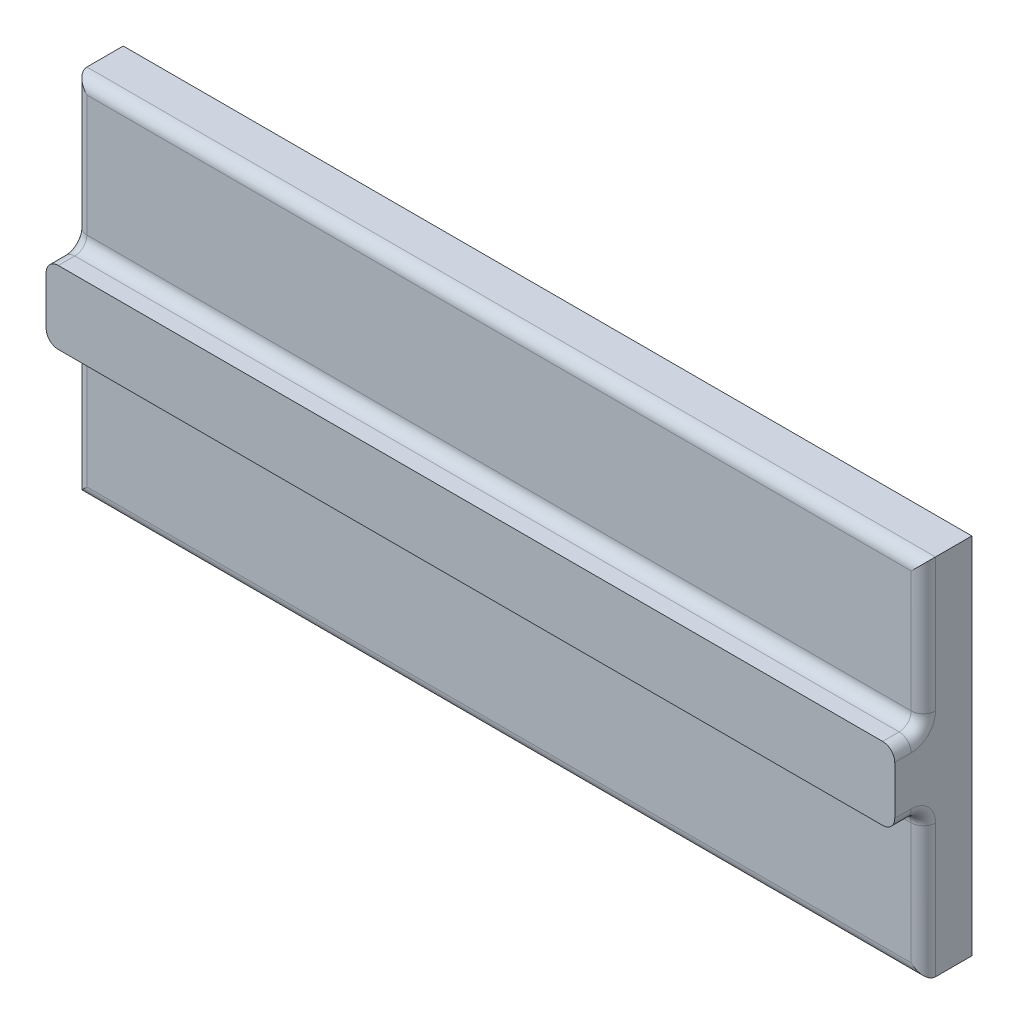
from build123d import *

# Parameters (mm, degrees)
SALIENTE_EXTRUIR1_DEPTH = 175
REDONDEO1_R             = 5


with BuildPart() as part:
    # Croquis1 → Saliente-Extruir1 (new, symmetric)
    with BuildSketch(Plane(origin=(0, 0, 0), x_dir=(0, 0, -1), z_dir=(1, 0, 0))):
        Polygon((-21.789612973, 0), (-21.789612973, 15), (-10, 15), (-10, 75), (10, 75), (10, -75), (-10, -75), (-10, -15), (-21.789612973, -15), align=None)
    extrude(amount=SALIENTE_EXTRUIR1_DEPTH, both=True)

    # Redondeo1
    redondeo1_edges = [part.edges().sort_by_distance(p)[0] for p in [
        (-175, -45, 10),
        (-175, -15, 15.894806486),
        (-175, 15, 15.894806486),
        (-175, 45, 10),
        (0, 75, 10),
        (0, -75, 10),
        (0, -15, 10),
        (0, 15, 10),
        (175, -15, 15.894806486),
        (175, -45, 10),
        (175, 45, 10),
        (175, 15, 15.894806486),
    ]]
    fillet(redondeo1_edges, radius=REDONDEO1_R)


solid = part.part
